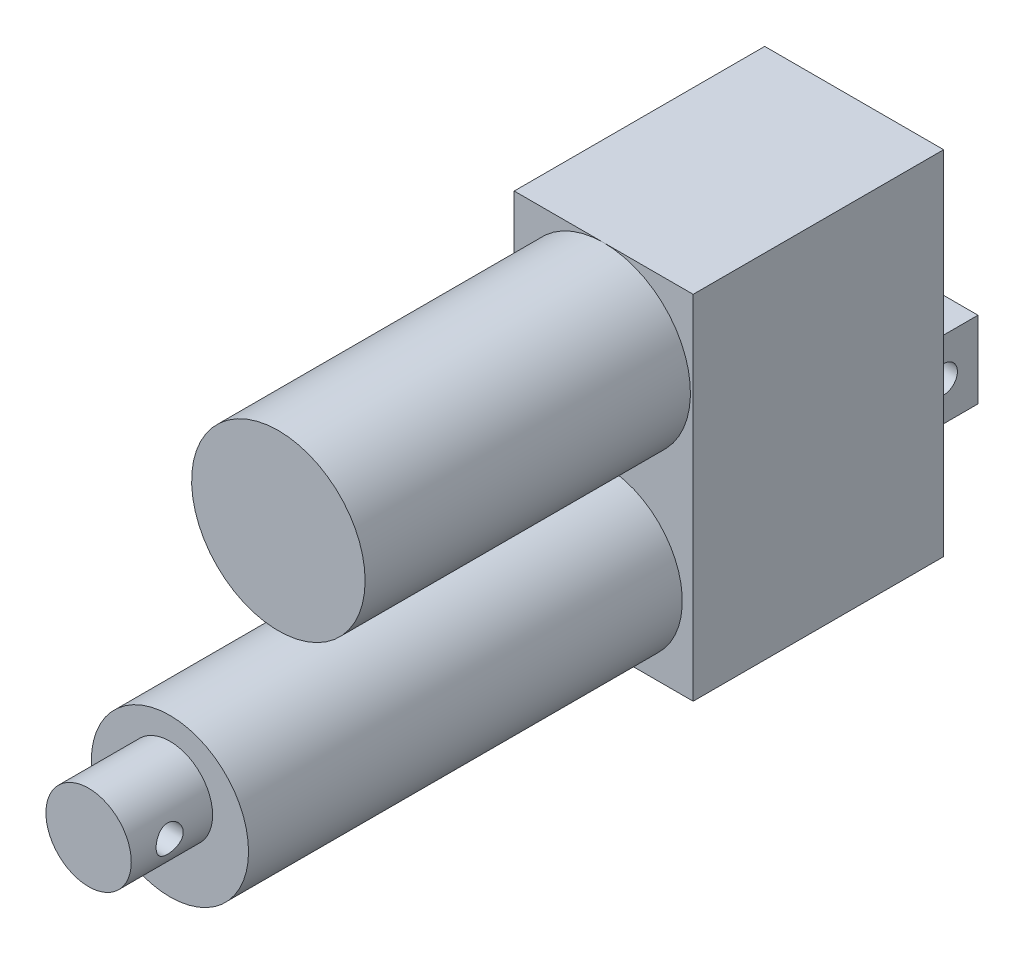
from build123d import *

# Parameters (mm, degrees)
SKETCH1_W               = 41.91
SKETCH1_H               = 82.55
BOSS_EXTRUDE1_DEPTH     = 58.674
SKETCH2_R               = 20.32
BOSS_EXTRUDE2_DEPTH     = 76.2
SKETCH3_R               = 18.415
BOSS_EXTRUDE3_DEPTH     = 101.6
SKETCH4_R               = 9.9949
BOSS_EXTRUDE4_DEPTH     = 19.05
CUT_EXTRUDE1_DEPTH      = 19.05
CUT_EXTRUDE1_DEPTH_BACK = 19.05
SKETCH6_R               = 3.175
SKETCH7_W               = 18
SKETCH7_H               = 18
BOSS_EXTRUDE5_DEPTH     = 20
CUT_EXTRUDE2_DEPTH      = 20
CUT_EXTRUDE2_DEPTH_BACK = 20
SKETCH8_R               = 3.175


with BuildPart() as part:
    # Sketch1 → Boss-Extrude1 (new body)
    with BuildSketch(Plane.XY):
        with Locations((0, 41.275)):
            Rectangle(SKETCH1_W, SKETCH1_H)
    extrude(amount=BOSS_EXTRUDE1_DEPTH)

    # Sketch2 → Boss-Extrude2 (add)
    with BuildSketch(Plane.XY.offset(58.674)):
        with Locations((0, 62.23)):
            Circle(SKETCH2_R)
    extrude(amount=BOSS_EXTRUDE2_DEPTH)

    # Sketch3 → Boss-Extrude3 (add)
    with BuildSketch(Plane.XY.offset(58.674)):
        with Locations((0, 19.05)):
            Circle(SKETCH3_R)
    extrude(amount=BOSS_EXTRUDE3_DEPTH)

    # Sketch4 → Boss-Extrude4 (add)
    with BuildSketch(Plane.XY.offset(160.274)):
        with Locations((0, 22.225)):
            Circle(SKETCH4_R)
    extrude(amount=BOSS_EXTRUDE4_DEPTH)

    # Sketch6 → Cut-Extrude1 (cut, two sides: drawn at the far end of the back side and taken through both)
    with BuildSketch(Plane(origin=(0, 0, 0), x_dir=(0, 0, -1), z_dir=(1, 0, 0)).offset(-CUT_EXTRUDE1_DEPTH_BACK)):
        with Locations((-170.324, 22.225)):
            Circle(SKETCH6_R)
    extrude(amount=CUT_EXTRUDE1_DEPTH + CUT_EXTRUDE1_DEPTH_BACK, mode=Mode.SUBTRACT)

    # Sketch7 → Boss-Extrude5 (add)
    with BuildSketch(Plane(origin=(0, 0, 0), x_dir=(-1, 0, 0), z_dir=(0, 0, -1))):
        with Locations((0, 24)):
            Rectangle(SKETCH7_W, SKETCH7_H)
    extrude(amount=BOSS_EXTRUDE5_DEPTH)

    # Sketch8 → Cut-Extrude2 (cut, two sides: drawn at the far end of the back side and taken through both)
    with BuildSketch(Plane.ZY.offset(9).offset(-CUT_EXTRUDE2_DEPTH_BACK)):
        with Locations((-12, 24)):
            Circle(SKETCH8_R)
    extrude(amount=CUT_EXTRUDE2_DEPTH + CUT_EXTRUDE2_DEPTH_BACK, mode=Mode.SUBTRACT)


solid = part.part
